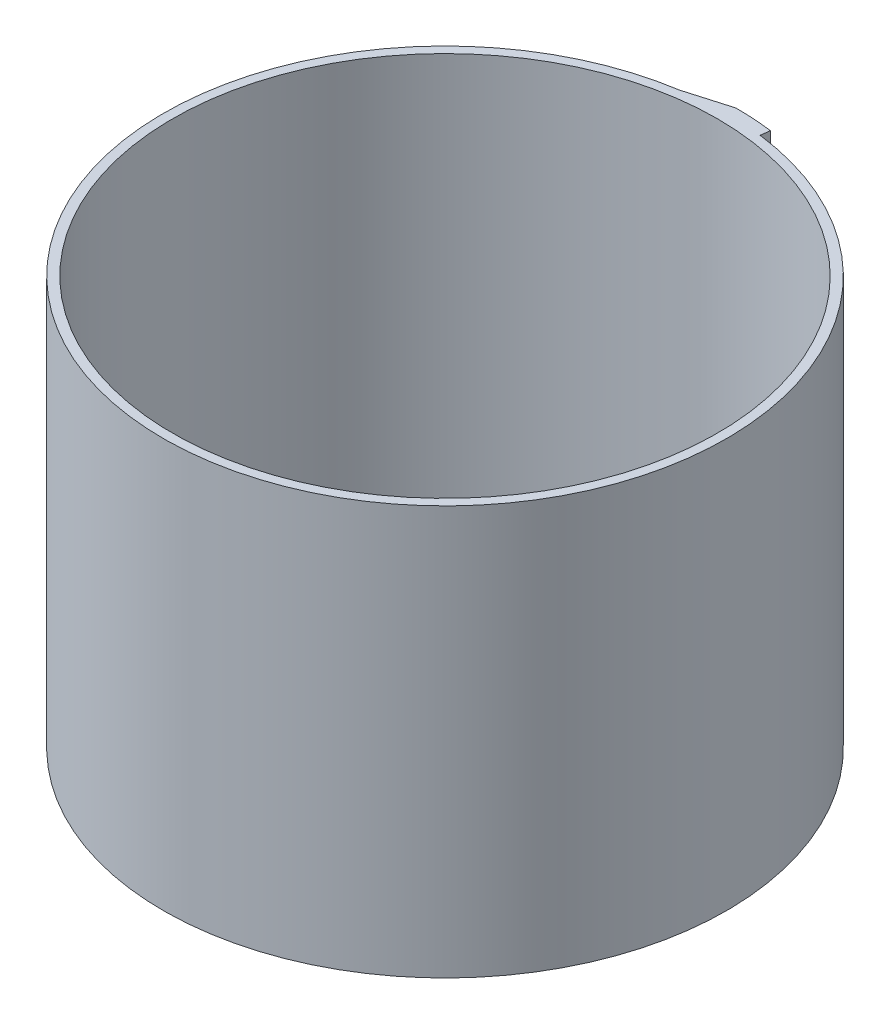
from build123d import *

# Parameters (mm, degrees)
SKETCH1_R           = 31
SKETCH1_R_2         = 29.98
BOSS_EXTRUDE1_DEPTH = 45


with BuildPart() as part:
    # Sketch1 → Boss-Extrude1 (new body)
    # profile 1 of 3: a face of its own
    with BuildSketch(Plane(origin=(0, 0, 0), x_dir=(1, 0, 0), z_dir=(0, 1, 0))):
        with BuildLine():
            Line((0, 32.02), (0, 31))
            ThreePointArc((0, 31), (1.971621014, 30.937238251), (3.935258648, 30.749207134))
            Line((3.935258648, 30.749207134), (4.064741352, 31.76095524))
            ThreePointArc((4.064741352, 31.76095524), (2.036493705, 31.955173187), (0, 32.02))
        make_face()
    # profile 2 of 3: a face of its own
    with BuildSketch(Plane(origin=(0, 0, 0), x_dir=(1, 0, 0), z_dir=(0, 1, 0))):
        with BuildLine():
            ThreePointArc((-4.801706763, 30.625865084), (-2.408130228, 30.906324738), (0, 31))
            Line((0, 31), (0, 32.02))
            Line((0, 32.02), (-4.801706763, 30.625865084))
        make_face()
    # profile 3 of 3: a face of its own
    with BuildSketch(Plane(origin=(0, 0, 0), x_dir=(1, 0, 0), z_dir=(0, 1, 0))):
        Circle(SKETCH1_R)
        with Locations(Location((0, 0, 0), (0, 0, 90))):
            Circle(SKETCH1_R_2, mode=Mode.SUBTRACT)
    extrude(amount=BOSS_EXTRUDE1_DEPTH)


solid = part.part
